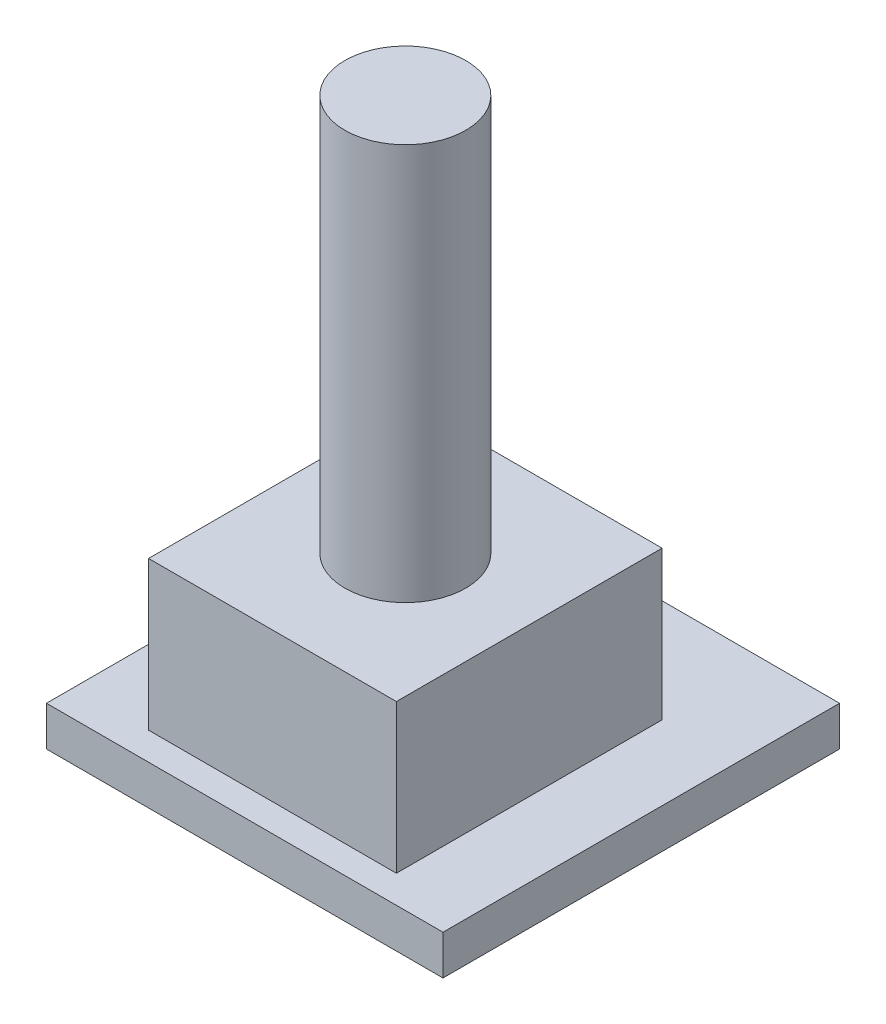
from build123d import *

# Parameters (mm, degrees)
SKETCH2_W           = 12.5
SKETCH2_H           = 13.4
BOSS_EXTRUDE1_DEPTH = 7.5
SKETCH3_R           = 3.05
BOSS_EXTRUDE2_DEPTH = 20
SKETCH4_W           = 20
SKETCH4_H           = 20
BOSS_EXTRUDE3_DEPTH = 2


with BuildPart() as part:
    # Sketch2 → Boss-Extrude1 (new body)
    with BuildSketch(Plane(origin=(0, 0, 0), x_dir=(1, 0, 0), z_dir=(0, 1, 0))):
        Rectangle(SKETCH2_W, SKETCH2_H)
    extrude(amount=BOSS_EXTRUDE1_DEPTH)

    # Sketch3 → Boss-Extrude2 (add)
    with BuildSketch(Plane(origin=(0, 7.5, 0), x_dir=(1, 0, 0), z_dir=(0, 1, 0))):
        with Locations(Location((0, 0, 0), (0, 0, 270))):
            Circle(SKETCH3_R)
    extrude(amount=BOSS_EXTRUDE2_DEPTH)

    # Sketch4 → Boss-Extrude3 (add)
    with BuildSketch(Plane.XZ):
        with Locations((0, -1.9)):
            Rectangle(SKETCH4_W, SKETCH4_H)
    extrude(amount=BOSS_EXTRUDE3_DEPTH)


solid = part.part
